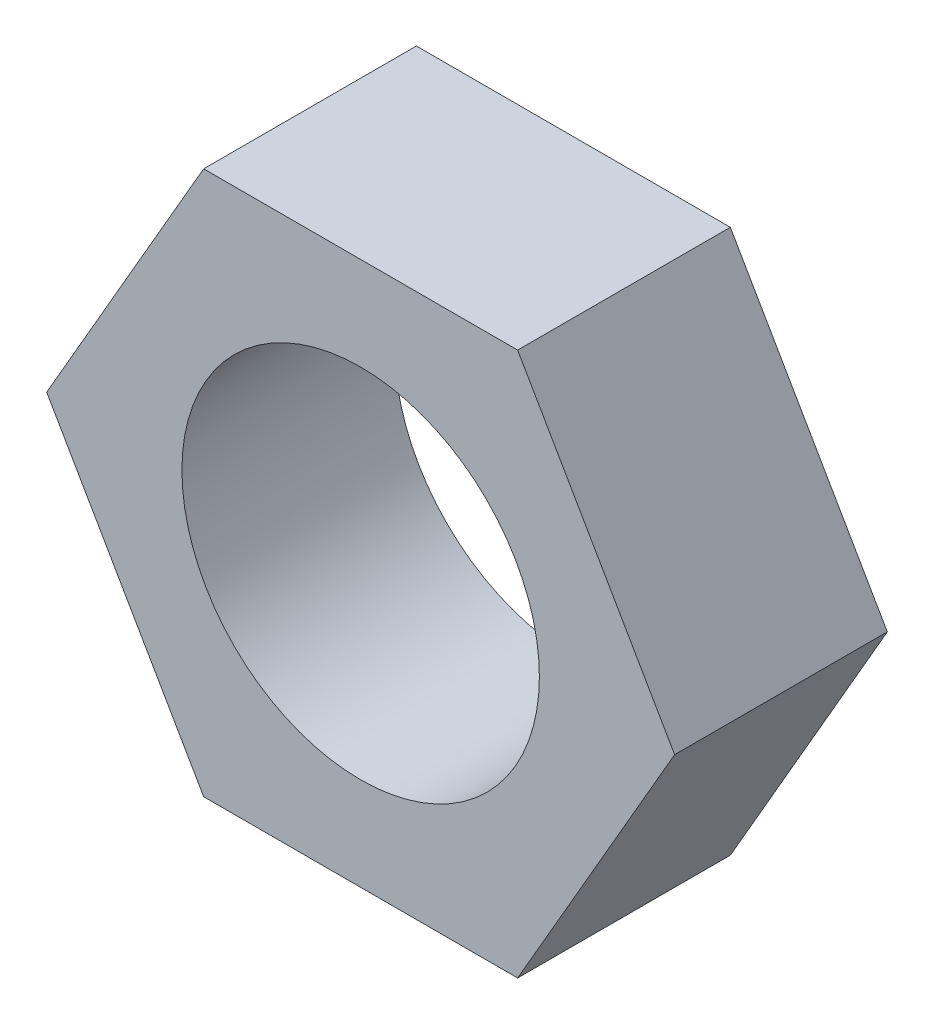
from build123d import *

# Parameters (mm, degrees)
BOSS_EXTRU_1_DEPTH      = 5
ESQUISSE2_R             = 4.201538882
ENL_V_MAT_EXTRU_1_DEPTH = 11.969436785


with BuildPart() as part:
    # Esquisse1 → Boss.-Extru.1 (new body)
    with BuildSketch(Plane.XY):
        Polygon((7.380613346, 0), (3.690306673, 6.391798653), (-3.690306673, 6.391798653), (-7.380613346, 0), (-3.690306673, -6.391798653), (3.690306673, -6.391798653), align=None)
    extrude(amount=BOSS_EXTRU_1_DEPTH)

    # Esquisse2 → Enlèv. mat.-Extru.1 (cut, through all)
    with BuildSketch(Plane(origin=(0, 0, 0), x_dir=(-1, 0, 0), z_dir=(0, 0, -1))):
        Circle(ESQUISSE2_R)
    extrude(amount=-ENL_V_MAT_EXTRU_1_DEPTH, mode=Mode.SUBTRACT)


solid = part.part
